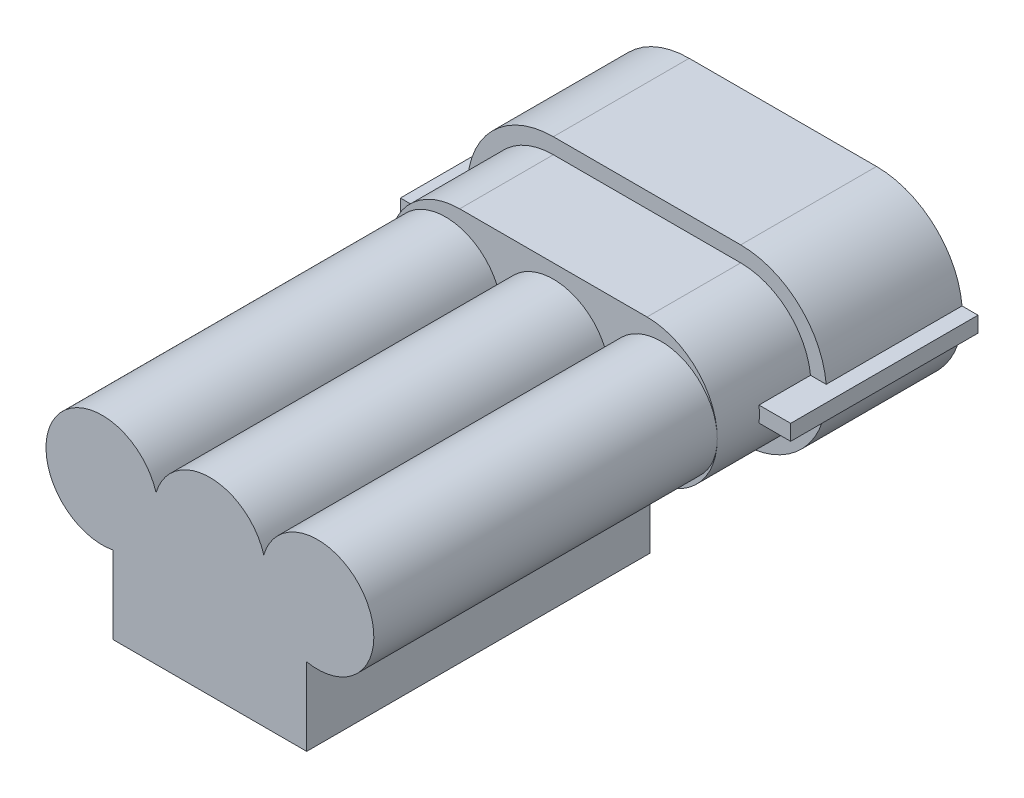
from build123d import *

# Parameters (mm, degrees)
EXTRUDE_1_DEPTH  = 8.7
EXTRUDE_2_DEPTH  = 6
EXTRUDE_7_DEPTH  = 22
EXTRUDE_15_REACH = 42.002
SKETCH_6_W       = 12.4
SKETCH_6_H       = 36.7
EXTRUDE_16_REACH = 46.194
SKETCH_10_W      = 12
SKETCH_10_H      = 1
SKETCH_11_W      = 12.4
SKETCH_11_H      = 22
EXTRUDE_17_DEPTH = 3


with BuildPart() as part:
    # ｽｹｯﾁ1 → ﾎﾞｽ - 押し出し1 (new body)
    with BuildSketch(Plane.XY):
        with BuildLine():
            Line((-6, 5.5), (6, 5.5))
            ThreePointArc((6, 5.5), (11.5, 0), (6, -5.5))
            Line((6, -5.5), (-6, -5.5))
            ThreePointArc((-6, -5.5), (-11.5, 0), (-6, 5.5))
        make_face()
    extrude(amount=EXTRUDE_1_DEPTH)

    # ｽｹｯﾁ4 → ﾎﾞｽ - 押し出し2 (add)
    with BuildSketch(Plane.XY.offset(8.7)):
        with BuildLine():
            Line((-6, -4.5), (6, -4.5))
            ThreePointArc((6, -4.5), (10.5, 0), (6, 4.5))
            Line((6, 4.5), (-6, 4.5))
            ThreePointArc((-6, 4.5), (-10.5, 0), (-6, -4.5))
        make_face()
    extrude(amount=EXTRUDE_2_DEPTH)

    # ｽｹｯﾁ5 → ﾎﾞｽ - 押し出し7 (add)
    with BuildSketch(Plane.XY.offset(14.7)):
        with BuildLine():
            ThreePointArc((-3.45, 1.02834819), (-10.5, 0), (-3.45, -1.02834819))
            ThreePointArc((-3.45, -1.02834819), (0, -3.6), (3.45, -1.02834819))
            ThreePointArc((3.45, -1.02834819), (10.5, 0), (3.45, 1.02834819))
            ThreePointArc((3.45, 1.02834819), (0, 3.6), (-3.45, 1.02834819))
        make_face()
    extrude(amount=EXTRUDE_7_DEPTH)

    # ｽｹｯﾁ6 → ﾎﾞｽ - 押し出し15 (add, up to next)
    with BuildSketch(Plane.XZ.offset(5.5), mode=Mode.PRIVATE) as extrude_15_sk1:
        with Locations((0, 18.35)):
            Rectangle(SKETCH_6_W, SKETCH_6_H)
    extrude_15_tool1 = extrude(extrude_15_sk1.sketch, amount=-EXTRUDE_15_REACH, mode=Mode.PRIVATE) - part.part
    add(extrude_15_tool1.solids().sort_by_distance((0, -5.5, 18.35))[0])

    # ｽｹｯﾁ10 → ﾎﾞｽ - 押し出し16 (add, up to next)
    with BuildSketch(Plane(origin=(12.5, 0, 0), x_dir=(0, 0, -1), z_dir=(1, 0, 0)), mode=Mode.PRIVATE) as extrude_16_sk1:
        with Locations((-6, 0)):
            Rectangle(SKETCH_10_W, SKETCH_10_H)
    extrude_16_tool1 = extrude(extrude_16_sk1.sketch, amount=-EXTRUDE_16_REACH, mode=Mode.PRIVATE) - part.part
    extrude_16 = extrude_16_tool1.solids().sort_by_distance((12.5, 0, 6))[0]
    add(extrude_16)

    # ﾐﾗｰ1: ﾎﾞｽ - 押し出し16 across plane
    add(extrude_16.mirror(Plane(origin=(0, 0, 0), x_dir=(0, 0, 1), z_dir=(1, 0, 0))))

    # ｽｹｯﾁ11 → ﾎﾞｽ - 押し出し17 (add)
    with BuildSketch(Plane.XZ.offset(5.5)):
        with Locations((0, 25.7)):
            Rectangle(SKETCH_11_W, SKETCH_11_H)
    extrude(amount=EXTRUDE_17_DEPTH)


solid = part.part
